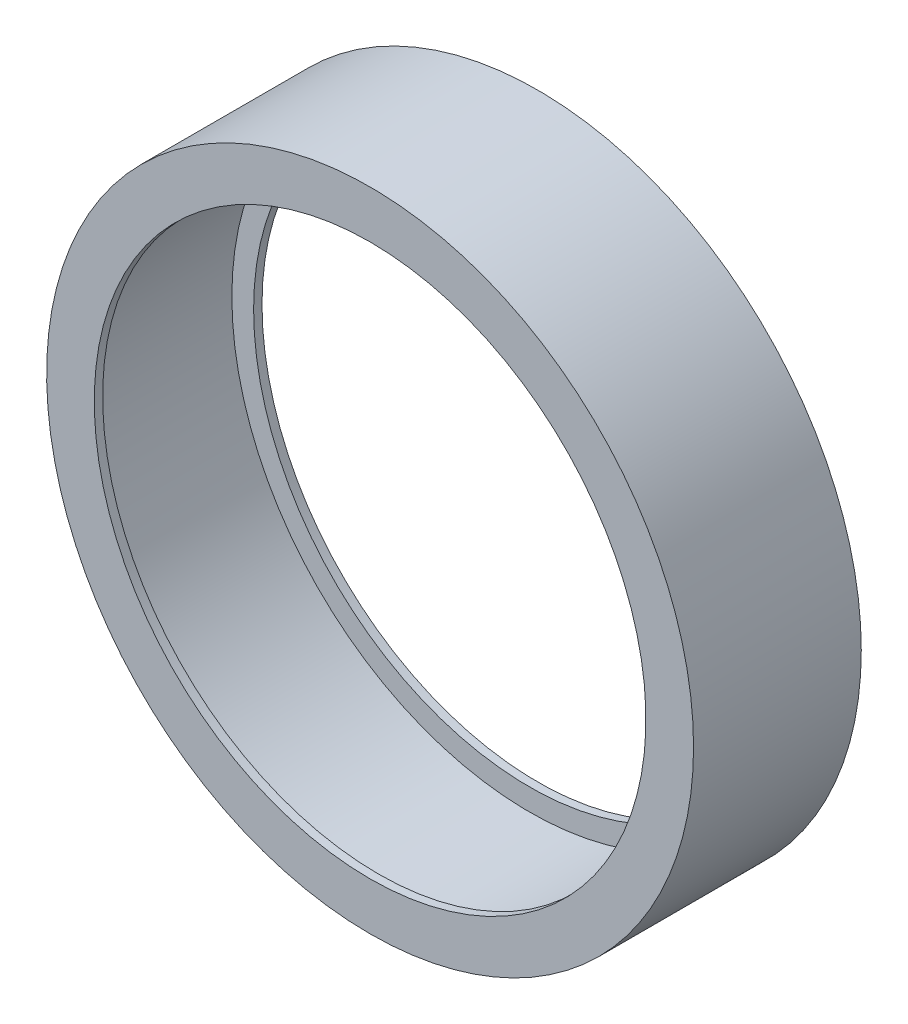
from build123d import *

# Parameters (mm, degrees)
SKETCH1_R           = 125
SKETCH1_R_2         = 115
BOSS_EXTRUDE1_DEPTH = 100
SKETCH2_R           = 115
SKETCH2_R_2         = 106.591324493
BOSS_EXTRUDE2_DEPTH = 5
BOSS_EXTRUDE3_START = -5
SKETCH3_R           = 115
SKETCH3_R_2         = 106.591324493
BOSS_EXTRUDE3_DEPTH = 5
SCALE1_SCALE_X      = 1.08
SCALE1_SCALE_Y      = 1.08
SCALE1_SCALE_Z      = 0.7


with BuildPart() as part:
    # Sketch1 → Boss-Extrude1 (new body)
    with BuildSketch(Plane.XY):
        Circle(SKETCH1_R)
        Circle(SKETCH1_R_2, mode=Mode.SUBTRACT)
    extrude(amount=BOSS_EXTRUDE1_DEPTH)

    # Sketch2 → Boss-Extrude2 (add)
    with BuildSketch(Plane(origin=(0, 0, 0), x_dir=(-1, 0, 0), z_dir=(0, 0, -1))):
        Circle(SKETCH2_R)
        Circle(SKETCH2_R_2, mode=Mode.SUBTRACT)
    extrude(amount=-BOSS_EXTRUDE2_DEPTH)

    # Sketch3 → Boss-Extrude3 (add)
    with BuildSketch(Plane.XY.offset(100).offset(BOSS_EXTRUDE3_START)):
        with Locations(Location((0, 0, 0), (0, 0, 180))):
            Circle(SKETCH3_R)
        with Locations(Location((0, 0, 0), (0, 0, 180))):
            Circle(SKETCH3_R_2, mode=Mode.SUBTRACT)
    extrude(amount=BOSS_EXTRUDE3_DEPTH)


with BuildPart() as part_1:
    # Scale1: scaled about (0, 0, 50)
    add(part.part.scale((SCALE1_SCALE_X, SCALE1_SCALE_Y, SCALE1_SCALE_Z), about=(0, 0, 50)))


solid = part_1.part
